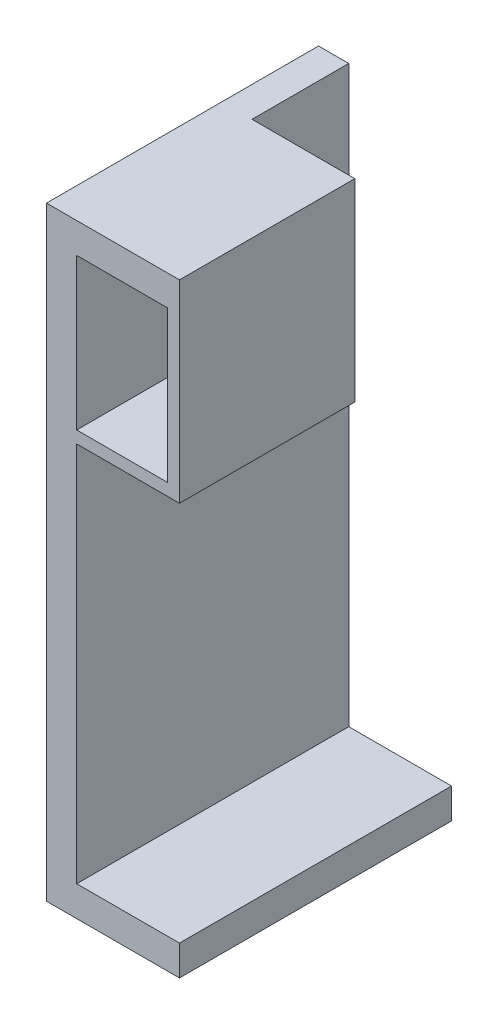
from build123d import *

# Parameters (mm, degrees)
SKETCH1_W           = 100
SKETCH1_H           = 75
BOSS_EXTRUDE1_DEPTH = 45
SKETCH2_W           = 15
SKETCH2_H           = 25
CUT_EXTRUDE1_DEPTH  = 78.014609004
SKETCH3_W           = 30.197143083
SKETCH3_H           = 100
CUT_EXTRUDE2_DEPTH  = 78.014609004
SKETCH4_W           = 17
SKETCH4_H           = 32
CUT_EXTRUDE3_DEPTH  = 16


with BuildPart() as part:
    # Sketch1 → Boss-Extrude1 (new body)
    with BuildSketch(Plane(origin=(0, 0, 0), x_dir=(0, 1, 0), z_dir=(0, 0, 1))):
        Rectangle(SKETCH1_W, SKETCH1_H)
    extrude(amount=BOSS_EXTRUDE1_DEPTH)

    # Sketch2 → Cut-Extrude1 (cut, through all)
    with BuildSketch(Plane.XY.offset(45)):
        Polygon((-15.5, 18), (-32.5, 18), (-32.5, -45), (32.5, -45), (32.5, 45), (-15.5, 45), (-15.5, 20), align=None)
        with Locations((-25, 32.5)):
            Rectangle(SKETCH2_W, SKETCH2_H)
    extrude(amount=-CUT_EXTRUDE1_DEPTH, mode=Mode.SUBTRACT)

    # Sketch3 → Cut-Extrude2 (cut, through all)
    with BuildSketch(Plane.XY.offset(45)):
        with Locations((-0.401428459, 0)):
            Rectangle(SKETCH3_W, SKETCH3_H)
    extrude(amount=-CUT_EXTRUDE2_DEPTH, mode=Mode.SUBTRACT)


with BuildPart() as cut_extrude2_kept_piece:
    # of the separate pieces the step leaves, the one the design keeps (cut_extrude2_pieces_kept)
    add(part.part.solids().sort_by_distance((-37.5, -50, 0))[0])

    # Sketch4 → Cut-Extrude3 (cut)
    with BuildSketch(Plane.XY):
        with Locations((-24, 34)):
            Rectangle(SKETCH4_W, SKETCH4_H)
    extrude(amount=CUT_EXTRUDE3_DEPTH, mode=Mode.SUBTRACT)


solid = cut_extrude2_kept_piece.part
